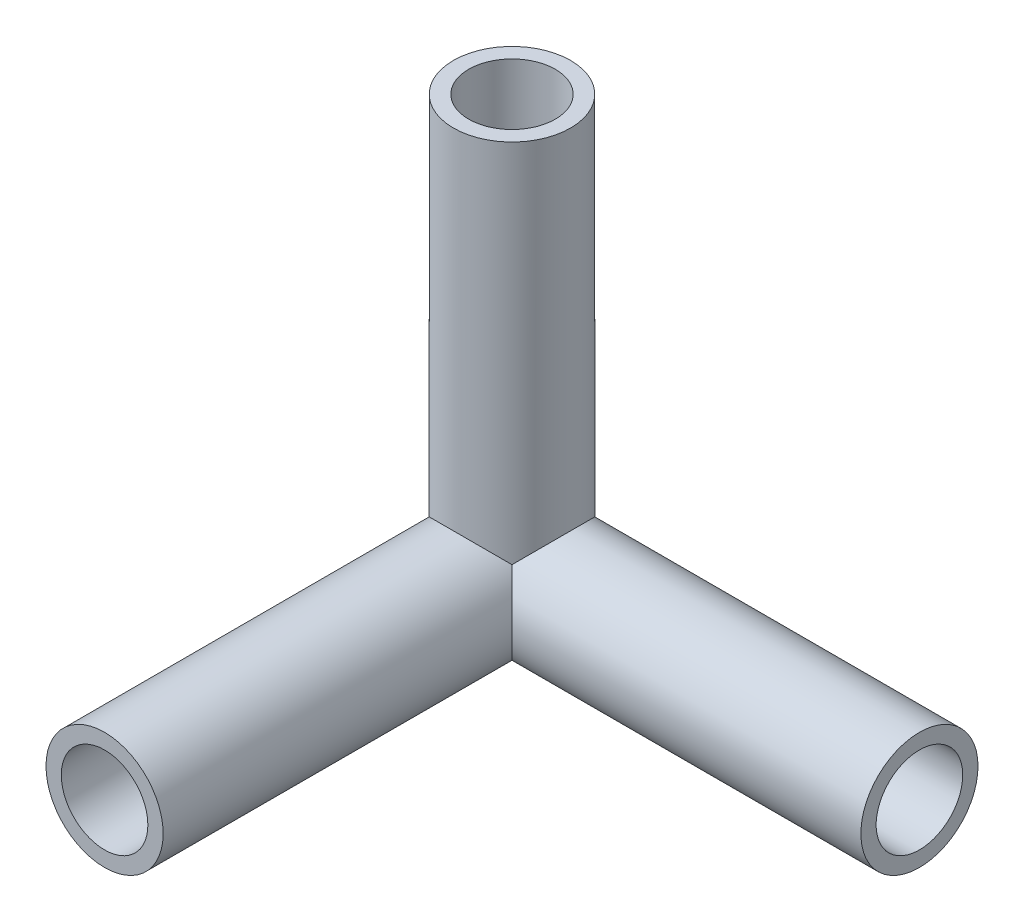
from build123d import *

# Parameters (mm, degrees)
SKETCH_1_R      = 5.75
SKETCH_1_R_2    = 4.25
EXTRUDE_1_DEPTH = 40
SKETCH_2_R      = 5.75
SKETCH_2_R_2    = 4.25
EXTRUDE_2_DEPTH = 40
SKETCH_3_R      = 5.75
SKETCH_3_R_2    = 4.25
EXTRUDE_3_DEPTH = 40


with BuildPart() as part:
    # 草图1 → 凸台-拉伸1 (new body)
    with BuildSketch(Plane.XY):
        Circle(SKETCH_1_R)
        Circle(SKETCH_1_R_2, mode=Mode.SUBTRACT)
    extrude(amount=EXTRUDE_1_DEPTH)

    # 草图2 → 凸台-拉伸2 (add)
    with BuildSketch(Plane(origin=(0, 0, 0), x_dir=(1, 0, 0), z_dir=(0, 1, 0))):
        with Locations(Location((0, 0, 0), (0, 0, 180))):
            Circle(SKETCH_2_R)
        Circle(SKETCH_2_R_2, mode=Mode.SUBTRACT)
    extrude(amount=EXTRUDE_2_DEPTH)

    # 草图3 → 凸台-拉伸3 (add)
    with BuildSketch(Plane(origin=(0, 0, 0), x_dir=(0, 0, -1), z_dir=(1, 0, 0))):
        Circle(SKETCH_3_R)
        Circle(SKETCH_3_R_2, mode=Mode.SUBTRACT)
    extrude(amount=EXTRUDE_3_DEPTH)

    # 草图4 → 旋转1 (revolve)
    with BuildSketch(Plane(origin=(0, 0, 0), x_dir=(-1, 0, 0), z_dir=(0, 0, -1)), mode=Mode.PRIVATE) as revolve_1_sk:
        with BuildLine():
            Line((4.25, 0), (5.75, 0))
            ThreePointArc((5.75, 0), (4.065863992, -4.065863992), (0, -5.75))
            Line((0, -5.75), (0, -4.25))
            ThreePointArc((0, -4.25), (3.00520382, -3.00520382), (4.25, 0))
        make_face()
    revolve(revolve_1_sk.sketch.rotate(Axis((0, -4.25, 0), (0, 1, 0)), 270), axis=Axis((0, -4.25, 0), (0, 1, 0)))


solid = part.part
